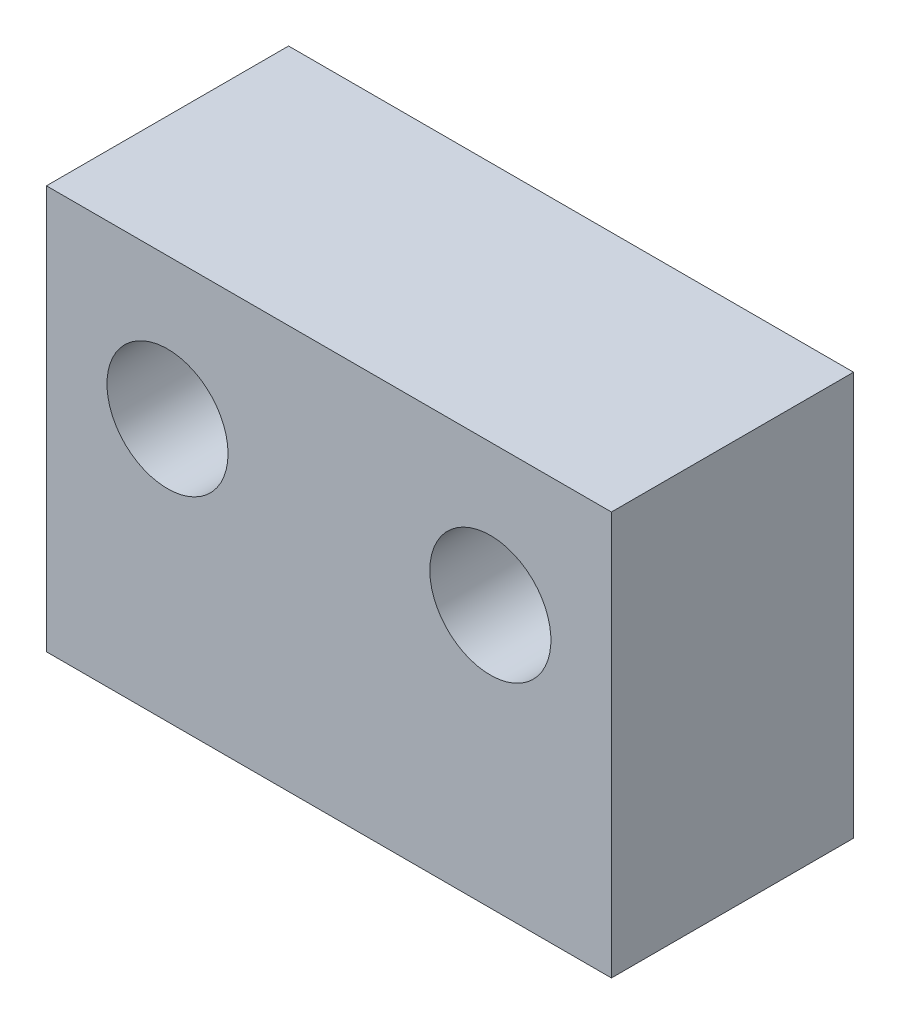
from build123d import *

# Parameters (mm, degrees)
SKETCH_1_W          = 14
SKETCH_1_H          = 10
EXTRUDE_1_DEPTH     = 6
SKETCH_3_R          = 1.5
CUT_EXTRUDE_1_DEPTH = 11.488088482


with BuildPart() as part:
    # 草图1 → 凸台-拉伸1 (new body)
    with BuildSketch(Plane.XY):
        Rectangle(SKETCH_1_W, SKETCH_1_H)
    extrude(amount=EXTRUDE_1_DEPTH)

    # 草图3 → 切除-拉伸1 (cut, through all)
    with BuildSketch(Plane.XY.offset(6)):
        with Locations((-4, 1.5)):
            Circle(SKETCH_3_R)
        with Locations(Location((4, 1.5, 0), (0, 0, 180))):
            Circle(SKETCH_3_R)
    extrude(amount=-CUT_EXTRUDE_1_DEPTH, mode=Mode.SUBTRACT)


solid = part.part
